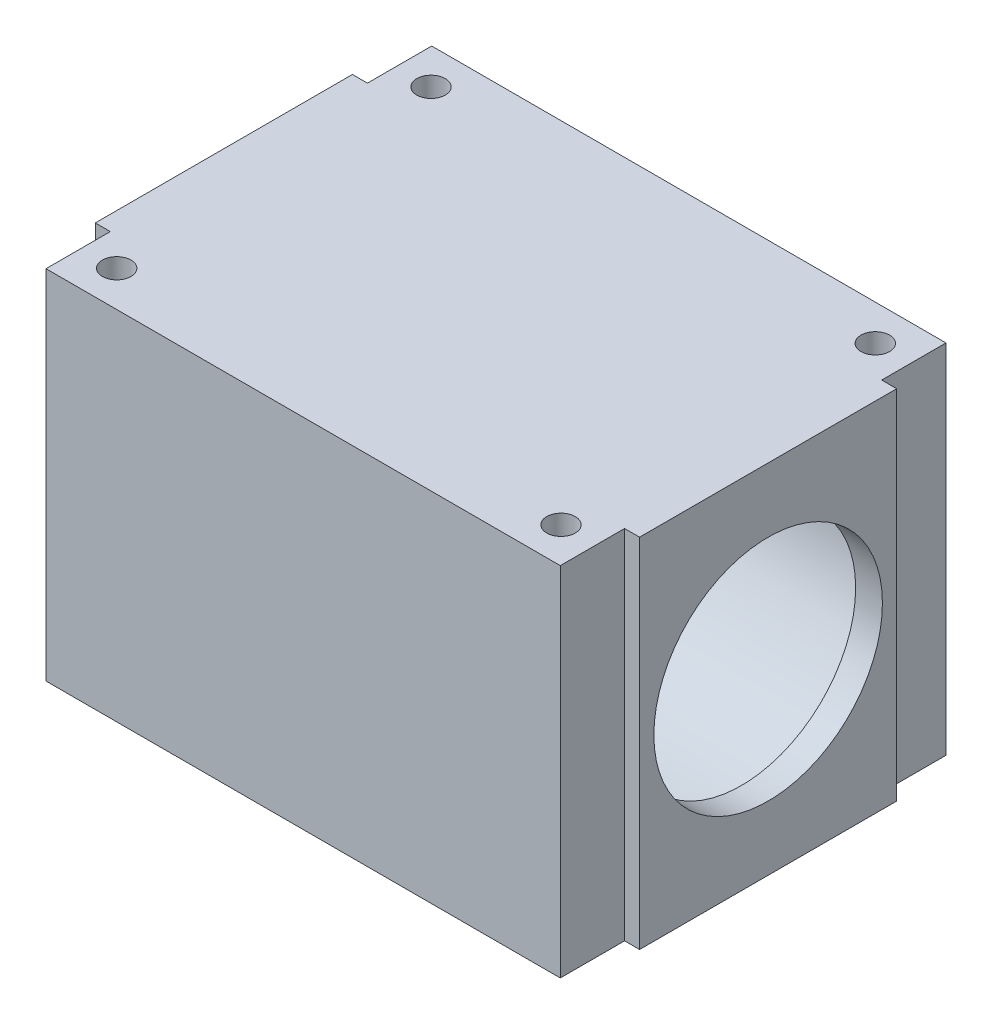
from build123d import *

# Parameters (mm, degrees)
SKETCH1_W           = 54
SKETCH1_H           = 50
SKETCH1_R           = 23.9
BOSS_EXTRUDE1_DEPTH = 68.2
SKETCH2_W           = 54
SKETCH2_H           = 50
SKETCH2_R           = 16
BOSS_EXTRUDE2_DEPTH = 2
LPATTERN1_COUNT     = 2
LPATTERN1_PITCH     = 70.2
SKETCH3_R           = 2
CUT_EXTRUDE1_DEPTH  = 7
BOSS_EXTRUDE5_START = 2
SKETCH7_W           = 54
SKETCH7_H           = 50
SKETCH7_R           = 16
BOSS_EXTRUDE5_DEPTH = 2
SKETCH6_W           = 54
SKETCH6_H           = 50
SKETCH6_R           = 16
BOSS_EXTRUDE6_DEPTH = 2
SKETCH8_R           = 23.9
CUT_EXTRUDE2_DEPTH  = 0.25
CUT_EXTRUDE3_START  = -0.25
SKETCH9_R           = 23.9
CUT_EXTRUDE3_DEPTH  = 0.25
SKETCH10_W          = 9
SKETCH10_H          = 50
CUT_EXTRUDE4_DEPTH  = 2.1
SKETCH11_W          = 9
SKETCH11_H          = 50
CUT_EXTRUDE5_DEPTH  = 2.1


with BuildPart() as part:
    # Sketch1 → Boss-Extrude1 (new body)
    with BuildSketch(Plane(origin=(0, 0, 0), x_dir=(0, 0, -1), z_dir=(1, 0, 0))):
        Rectangle(SKETCH1_W, SKETCH1_H)
        Circle(SKETCH1_R, mode=Mode.SUBTRACT)
    extrude(amount=BOSS_EXTRUDE1_DEPTH)

    # Sketch2 → Boss-Extrude2 (add)
    with BuildSketch(Plane(origin=(68.2, 0, 0), x_dir=(0, 0, -1), z_dir=(1, 0, 0))):
        Rectangle(SKETCH2_W, SKETCH2_H)
        Circle(SKETCH2_R, mode=Mode.SUBTRACT)
    boss_extrude2 = extrude(amount=BOSS_EXTRUDE2_DEPTH)

    # LPattern1: Boss-Extrude2 ×2
    with Locations(*[(-i * LPATTERN1_PITCH, 0, 0) for i in range(1, LPATTERN1_COUNT)]):
        add(boss_extrude2)

    # Sketch3 → Cut-Extrude1 (cut)
    with BuildSketch(Plane.XZ.offset(25)):
        with Locations(Location((3, 22, 0), (0, 0, 270))):
            Circle(SKETCH3_R)
        with Locations(Location((65.2, 22, 0), (0, 0, 270))):
            Circle(SKETCH3_R)
        with Locations(Location((65.2, -22, 0), (0, 0, 270))):
            Circle(SKETCH3_R)
        with Locations(Location((3, -22, 0), (0, 0, 270))):
            Circle(SKETCH3_R)
    cut_extrude1 = extrude(amount=-CUT_EXTRUDE1_DEPTH, mode=Mode.SUBTRACT)

    # Mirror1: Cut-Extrude1 across plane
    add(cut_extrude1.mirror(Plane.ZX), mode=Mode.SUBTRACT)

    # Sketch7 → Boss-Extrude5 (add)
    with BuildSketch(Plane.ZY.offset(2).offset(BOSS_EXTRUDE5_START)):
        Rectangle(SKETCH7_W, SKETCH7_H)
        with Locations(Location((0, 0, 0), (0, 0, 180))):
            Circle(SKETCH7_R, mode=Mode.SUBTRACT)
    extrude(amount=-BOSS_EXTRUDE5_DEPTH)

    # Sketch6 → Boss-Extrude6 (add)
    with BuildSketch(Plane(origin=(70.2, 0, 0), x_dir=(0, 0, -1), z_dir=(1, 0, 0))):
        Rectangle(SKETCH6_W, SKETCH6_H)
        Circle(SKETCH6_R, mode=Mode.SUBTRACT)
    extrude(amount=BOSS_EXTRUDE6_DEPTH)

    # Sketch8 → Cut-Extrude2 (cut)
    with BuildSketch(Plane.ZY.offset(-68.2)):
        Circle(SKETCH8_R)
    extrude(amount=-CUT_EXTRUDE2_DEPTH, mode=Mode.SUBTRACT)

    # Sketch9 → Cut-Extrude3 (cut)
    with BuildSketch(Plane(origin=(0, 0, 0), x_dir=(0, 0, -1), z_dir=(1, 0, 0)).offset(CUT_EXTRUDE3_START)):
        with Locations(Location((0, 0, 0), (0, 0, 180))):
            Circle(SKETCH9_R)
    extrude(amount=CUT_EXTRUDE3_DEPTH, mode=Mode.SUBTRACT)

    # Sketch10 → Cut-Extrude4 (cut)
    with BuildSketch(Plane(origin=(72.2, 0, 0), x_dir=(0, 0, -1), z_dir=(1, 0, 0))):
        with Locations((-22.5, 0)):
            Rectangle(SKETCH10_W, SKETCH10_H)
        with Locations((22.5, 0)):
            Rectangle(SKETCH10_W, SKETCH10_H)
    extrude(amount=-CUT_EXTRUDE4_DEPTH, mode=Mode.SUBTRACT)

    # Sketch11 → Cut-Extrude5 (cut)
    with BuildSketch(Plane.ZY.offset(4)):
        with Locations((-22.5, 0)):
            Rectangle(SKETCH11_W, SKETCH11_H)
        with Locations((22.5, 0)):
            Rectangle(SKETCH11_W, SKETCH11_H)
    extrude(amount=-CUT_EXTRUDE5_DEPTH, mode=Mode.SUBTRACT)


solid = part.part
